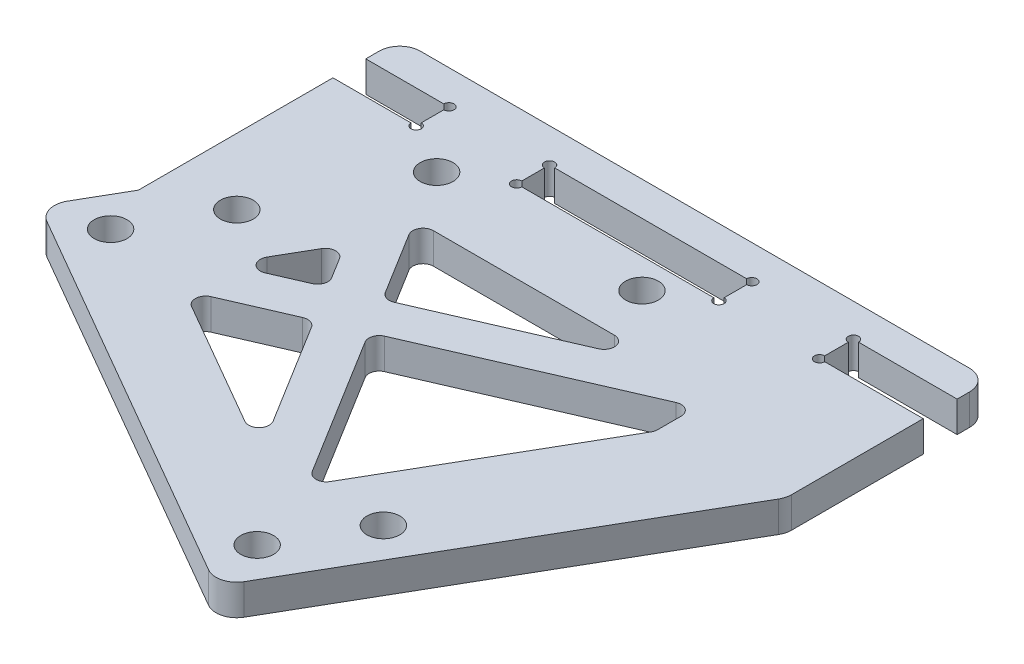
from build123d import *

# Parameters (mm, degrees)
SKETCH1_W           = 57.5
SKETCH1_H           = 3.408146715
SKETCH1_W_2         = 10
SKETCH1_H_2         = 3
SKETCH1_R           = 1.6
BOSS_EXTRUDE1_DEPTH = 3
SKETCH3_W           = 8.1
SKETCH3_H           = 3.2
SKETCH3_W_2         = 10.1
SKETCH3_H_2         = 3.3
SKETCH3_W_3         = 19.7
SKETCH3_W_4         = 19.5
SKETCH3_H_3         = 3
CUT_EXTRUDE1_DEPTH  = 3
SKETCH4_R           = 0.5
CUT_EXTRUDE2_DEPTH  = 3
SKETCH6_R           = 1.6
BOSS_EXTRUDE2_DEPTH = 3
SKETCH6_2_R         = 1.6
CUT_EXTRUDE3_DEPTH  = 3
CUT_EXTRUDE4_DEPTH  = 3
FILLET1_R           = 2
CUT_EXTRUDE5_DEPTH  = 3
EXTRUDE_THIN1_DEPTH = 3
FILLET2_R           = 1
BOSS_EXTRUDE3_DEPTH = 3
FILLET3_R           = 1


with BuildPart() as part:
    # Sketch1 → Boss-Extrude1 (new body)
    # profile 1 of 4: a face of its own
    with BuildSketch(Plane(origin=(0, 0, 0), x_dir=(1, 0, 0), z_dir=(0, 1, 0))):
        with Locations((15.75, 7.704073358)):
            Rectangle(SKETCH1_W, SKETCH1_H)
    # profile 2 of 4: a face of its own
    with BuildSketch(Plane(origin=(0, 0, 0), x_dir=(1, 0, 0), z_dir=(0, 1, 0))):
        with Locations((0, 4.5)):
            Rectangle(SKETCH1_W_2, SKETCH1_H_2)
    # profile 3 of 4: a face of its own
    with BuildSketch(Plane(origin=(0, 0, 0), x_dir=(1, 0, 0), z_dir=(0, 1, 0))):
        with Locations((29.5, 4.5)):
            Rectangle(SKETCH1_W_2, SKETCH1_H_2)
    # profile 4 of 4: a face of its own
    with BuildSketch(Plane(origin=(0, 0, 0), x_dir=(1, 0, 0), z_dir=(0, 1, 0))):
        Polygon((5, 3), (-5, 3), (-13, 3), (-13, -21.846492531), (44.5, -21.846492531), (44.5, 3), (34.5, 3), (24.5, 3), align=None)
        with Locations(Location((0, 0, 0), (0, 0, 270))):
            Circle(SKETCH1_R, mode=Mode.SUBTRACT)
        with Locations(Location((20, 0, 0), (0, 0, 270))):
            Circle(SKETCH1_R, mode=Mode.SUBTRACT)
    extrude(amount=BOSS_EXTRUDE1_DEPTH)

    # Sketch3 → Cut-Extrude1 (cut)
    # profile 1 of 3: a face of its own
    with BuildSketch(Plane(origin=(0, 3, 0), x_dir=(1, 0, 0), z_dir=(0, 1, 0))):
        with Locations((-8.95, 4.5)):
            Rectangle(SKETCH3_W, SKETCH3_H)
    # profile 2 of 3: a face of its own
    with BuildSketch(Plane(origin=(0, 3, 0), x_dir=(1, 0, 0), z_dir=(0, 1, 0))):
        with Locations((39.45, 4.55)):
            Rectangle(SKETCH3_W_2, SKETCH3_H_2)
    # profile 3 of 3: a face of its own
    with BuildSketch(Plane(origin=(0, 3, 0), x_dir=(1, 0, 0), z_dir=(0, 1, 0))):
        with Locations((14.75, 4.5)):
            Rectangle(SKETCH3_W_3, SKETCH3_H)
        with Locations((14.75, 4.5)):
            Rectangle(SKETCH3_W_4, SKETCH3_H_3, mode=Mode.SUBTRACT)
    extrude(amount=-CUT_EXTRUDE1_DEPTH, mode=Mode.SUBTRACT)

    # Sketch4 → Cut-Extrude2 (cut)
    with BuildSketch(Plane(origin=(0, 3, 0), x_dir=(1, 0, 0), z_dir=(0, 1, 0))):
        with Locations((-4.9, 6.1)):
            Circle(SKETCH4_R)
        with Locations((-4.9, 2.9)):
            Circle(SKETCH4_R)
        with Locations((4.9, 6.1)):
            Circle(SKETCH4_R)
        with Locations((4.9, 2.9)):
            Circle(SKETCH4_R)
        with Locations((24.6, 6.1)):
            Circle(SKETCH4_R)
        with Locations((24.6, 2.9)):
            Circle(SKETCH4_R)
        with Locations((34.4, 2.9)):
            Circle(SKETCH4_R)
        with Locations((34.4, 6.2)):
            Circle(SKETCH4_R)
    extrude(amount=-CUT_EXTRUDE2_DEPTH, mode=Mode.SUBTRACT)

    # Sketch6 → Boss-Extrude2 (add)
    with BuildSketch(Plane(origin=(0, 3, 0), x_dir=(1, 0, 0), z_dir=(0, 1, 0))):
        Polygon((-6.176738334, -4.232762247), (37.924895048, -21.846492531), (24.176946138, -45.658638544), (-16.52624784, -22.158638544), align=None)
        with Locations(Location((22.712844523, -40.194536929, 0), (0, 0, 270))):
            Circle(SKETCH6_R, mode=Mode.SUBTRACT)
        with Locations(Location((27.212844523, -32.400308295, 0), (0, 0, 270))):
            Circle(SKETCH6_R, mode=Mode.SUBTRACT)
        with Locations((-11.062146225, -20.694536929)):
            Circle(SKETCH6_R, mode=Mode.SUBTRACT)
        with Locations((-6.562146225, -12.900308295)):
            Circle(SKETCH6_R, mode=Mode.SUBTRACT)
    extrude(amount=-BOSS_EXTRUDE2_DEPTH)

    # Sketch6<2> → Cut-Extrude3 (cut)
    with BuildSketch(Plane(origin=(0, 3, 0), x_dir=(1, 0, 0), z_dir=(0, 1, 0))):
        with Locations(Location((-6.562146225, -12.900308295, 0), (0, 0, 270))):
            Circle(SKETCH6_2_R)
        with BuildLine():
            ThreePointArc((-12.172550786, -21.846492531), (-11.062146225, -22.294536929), (-9.951741663, -21.846492531))
            Line((-9.951741663, -21.846492531), (-12.172550786, -21.846492531))
        make_face()
        with BuildLine():
            Line((-12.172550786, -21.846492531), (-9.951741663, -21.846492531))
            ThreePointArc((-9.951741663, -21.846492531), (-9.589623339, -21.320377444), (-9.462146225, -20.694536929))
            ThreePointArc((-9.462146225, -20.694536929), (-11.68798674, -19.222014043), (-12.172550786, -21.846492531))
        make_face()
    extrude(amount=-CUT_EXTRUDE3_DEPTH, mode=Mode.SUBTRACT)

    # Sketch8 → Cut-Extrude4 (cut)
    with BuildSketch(Plane(origin=(0, 3, 0), x_dir=(1, 0, 0), z_dir=(0, 1, 0))):
        Polygon((37.924895048, -21.846492531), (47.152165502, -5.864391291), (51.952331521, -20.765599638), (44.5, -26.059092388), align=None)
    extrude(amount=-CUT_EXTRUDE4_DEPTH, mode=Mode.SUBTRACT)

    # Fillet1
    fillet1_edges = [part.edges().sort_by_distance(p)[0] for p in [
        (-16.52624784, 1.5, 22.158638544),
        (24.176946138, 1.5, 45.658638544),
        (44.5, 1.5, 10.45807669),
        (-13, 1.5, -9.408146715),
        (44.5, 1.5, -9.408146715),
    ]]
    fillet(fillet1_edges, radius=FILLET1_R)

    # Sketch9 → Cut-Extrude5 (cut)
    with BuildSketch(Plane(origin=(0, 3, 0), x_dir=(1, 0, 0), z_dir=(0, 1, 0))):
        Polygon((1, -5.1), (32.5, -5.1), (32.5, -11.242686381), (19.0166921, -34.596460718), (-4.365993802, -21.096460718), (1, -11.802286819), align=None)
    extrude(amount=-CUT_EXTRUDE5_DEPTH, mode=Mode.SUBTRACT)

    # Sketch10 → Extrude-Thin1 (add)
    with BuildSketch(Plane(origin=(0, 3, 0), x_dir=(1, 0, 0), z_dir=(0, 1, 0))):
        Polygon((-4.02917863, -23.038408895), (33.945296414, -6.53815934), (32.351236334, -2.869512115), (-5.623238711, -19.369761671), align=None)
        Polygon((-1.3111598, -5.755729233), (17.608558315, -36.351129247), (21.010628303, -34.247342235), (2.090910189, -3.651942221), align=None)
    extrude(amount=-EXTRUDE_THIN1_DEPTH)

    # Fillet2
    fillet2_edges = [part.edges().sort_by_distance(p)[0] for p in [
        (1, 1.5, 11.802286819),
        (32.5, 1.5, 11.242686381),
        (15.139105711, 1.5, 32.357735172),
        (-2.302171748, 1.5, 22.288008936),
        (20.083687523, 1.5, 32.748370433),
        (32.5, 1.5, 7.166153578),
        (2.986366531, 1.5, 5.1),
        (27.217883275, 1.5, 5.1),
        (-2.614232793, 1.5, 18.062321647),
        (4.411323294, 1.5, 15.009654597),
        (8.118301247, 1.5, 13.398939472),
        (10.244069028, 1.5, 16.836554938),
        (6.537091075, 1.5, 18.447270063),
    ]]
    fillet(fillet2_edges, radius=FILLET2_R)

    # Sketch11 → Boss-Extrude3 (add)
    with BuildSketch(Plane(origin=(0, 3, 0), x_dir=(1, 0, 0), z_dir=(0, 1, 0))):
        Polygon((0.814899894, -12.122889607), (2.271586452, -9.599834478), (-0.508630479, -8.514382996), align=None)
    extrude(amount=-BOSS_EXTRUDE3_DEPTH)

    # Fillet3
    fillet3_edges = [part.edges().sort_by_distance(p)[0] for p in [
        (1.689467225, 1.5, 10.608094556),
    ]]
    fillet(fillet3_edges, radius=FILLET3_R)


solid = part.part
